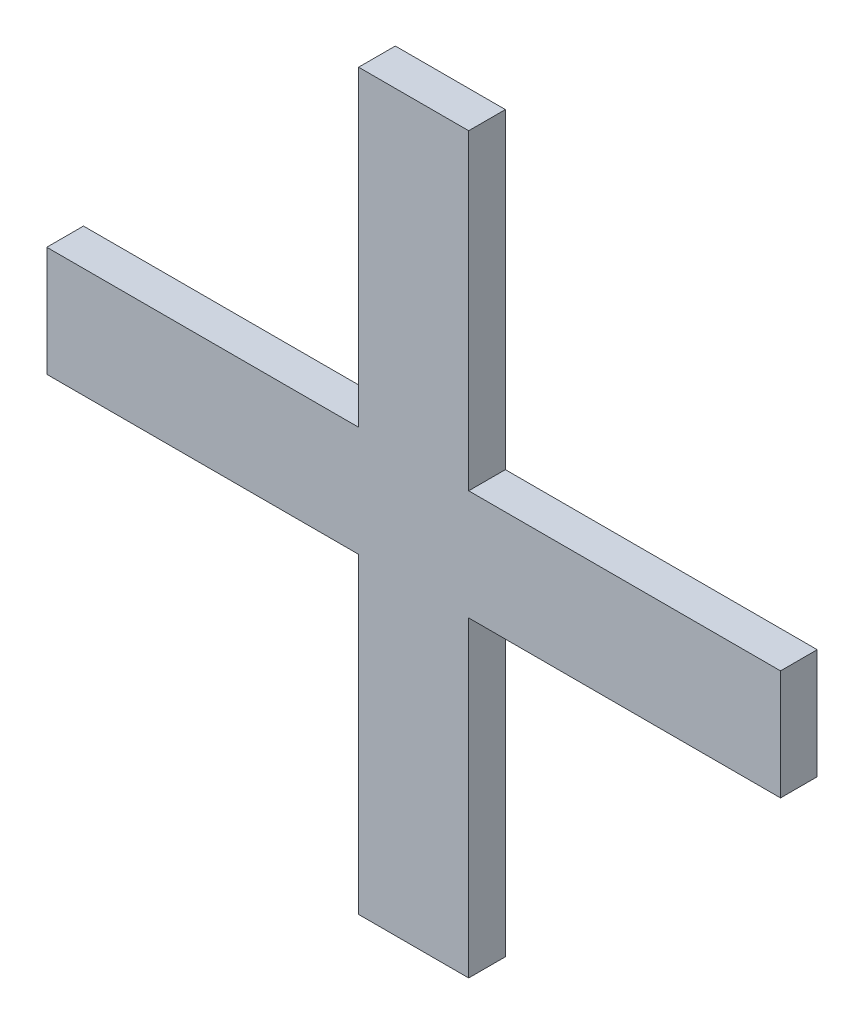
from build123d import *

# Parameters (mm, degrees)
SKETCH1_W           = 30
SKETCH1_H           = 200
BOSS_EXTRUDE1_DEPTH = 10
SKETCH2_W           = 200
SKETCH2_H           = 30
BOSS_EXTRUDE2_DEPTH = 10


with BuildPart() as part:
    # Sketch1 → Boss-Extrude1 (new body)
    with BuildSketch(Plane.XY):
        with Locations((-4910.272727273, -869.818181818)):
            Rectangle(SKETCH1_W, SKETCH1_H)
    extrude(amount=BOSS_EXTRUDE1_DEPTH)

    # Sketch2 → Boss-Extrude2 (add)
    with BuildSketch(Plane.XY):
        with Locations((-4910.272727273, -869.818181818)):
            Rectangle(SKETCH2_W, SKETCH2_H)
    extrude(amount=BOSS_EXTRUDE2_DEPTH)


solid = part.part
